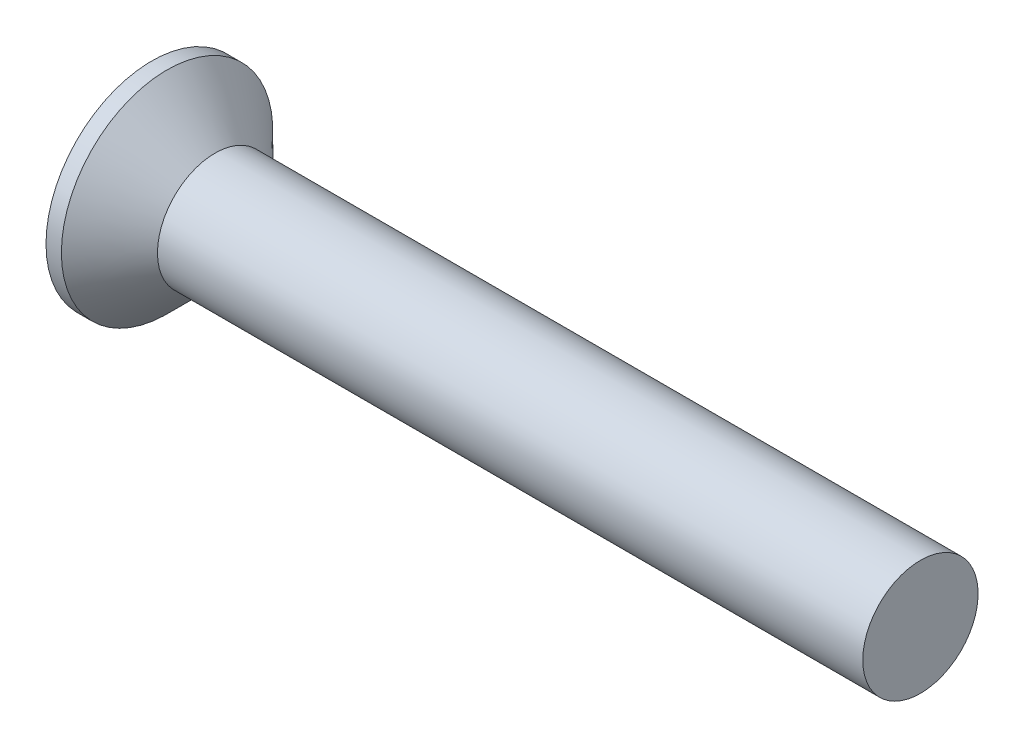
from build123d import *


with BuildPart() as part:
    # Esquisse1 → Révolution1 (revolve)
    with BuildSketch(Plane.XY, mode=Mode.PRIVATE) as r_volution1_sk:
        Polygon((0, 0), (20, 0), (20, 1.5), (1.65, 1.5), (0.4, 2.75), (0, 2.75), align=None)
    revolve(r_volution1_sk.sketch.rotate(Axis((0, 0, 0), (1, 0, 0)), 90), axis=Axis((0, 0, 0), (1, 0, 0)))


solid = part.part
